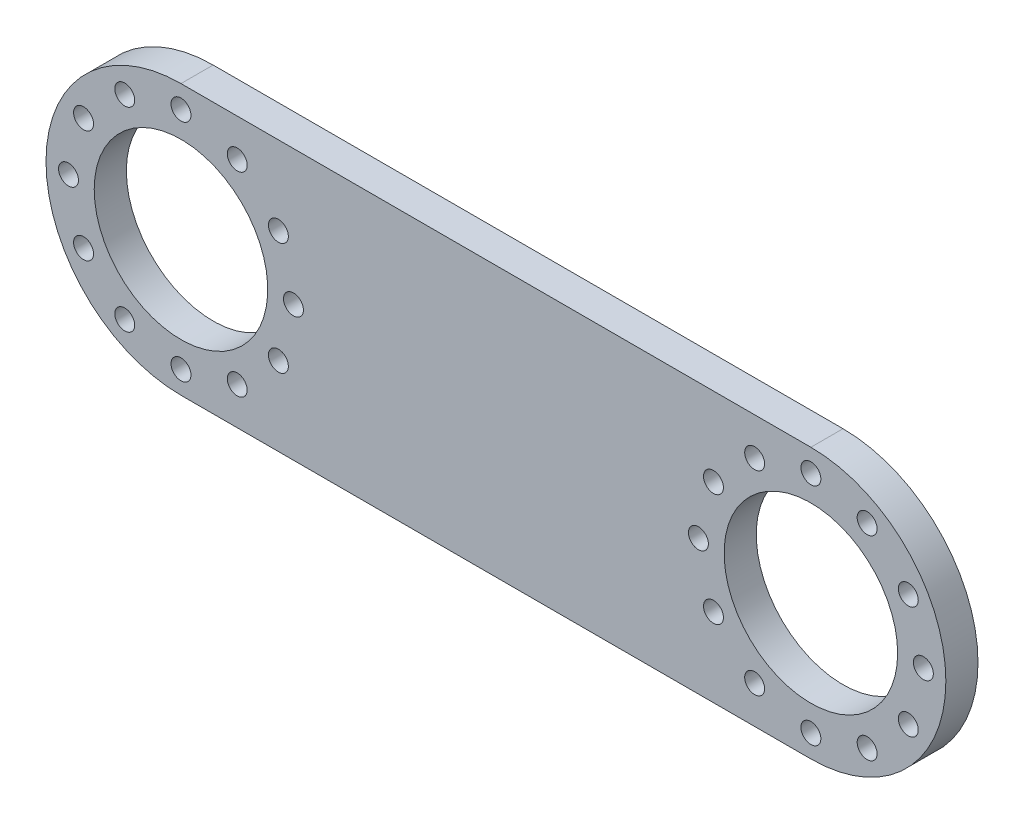
from build123d import *

# Parameters (mm, degrees)
EXTRUDE_1_DEPTH     = 5
SKETCH_2_R          = 13.5
SKETCH_2_R_2        = 1.55
CUT_EXTRUDE_1_DEPTH = 5


with BuildPart() as part:
    # 草图1 → 凸台-拉伸1 (new body)
    with BuildSketch(Plane.XY):
        with BuildLine():
            Line((-49, -21), (49, -21))
            ThreePointArc((49, -21), (70, 0), (49, 21))
            Line((49, 21), (-49, 21))
            ThreePointArc((-49, 21), (-70, 0), (-49, -21))
        make_face()
    extrude(amount=EXTRUDE_1_DEPTH)

    # 草图2 → 切除-拉伸1 (cut)
    with BuildSketch(Plane.XY.offset(5)):
        with Locations((49, 0)):
            Circle(SKETCH_2_R)
        with Locations((49, 17.5)):
            Circle(SKETCH_2_R_2)
        with Locations((57.75, 15.155444566)):
            Circle(SKETCH_2_R_2)
        with Locations((64.155444566, 8.75)):
            Circle(SKETCH_2_R_2)
        with Locations((66.5, 0)):
            Circle(SKETCH_2_R_2)
        with Locations((64.155444566, -8.75)):
            Circle(SKETCH_2_R_2)
        with Locations((57.75, -15.155444566)):
            Circle(SKETCH_2_R_2)
        with Locations((49, -17.5)):
            Circle(SKETCH_2_R_2)
        with Locations((40.25, -15.155444566)):
            Circle(SKETCH_2_R_2)
        with Locations((33.844555434, -8.75)):
            Circle(SKETCH_2_R_2)
        with Locations((31.5, 0)):
            Circle(SKETCH_2_R_2)
        with Locations((33.844555434, 8.75)):
            Circle(SKETCH_2_R_2)
        with Locations((40.25, 15.155444566)):
            Circle(SKETCH_2_R_2)
    cut_extrude_1 = extrude(amount=-CUT_EXTRUDE_1_DEPTH, mode=Mode.SUBTRACT)

    # 镜向1: 切除-拉伸1 across plane
    add(cut_extrude_1.mirror(Plane(origin=(0, 0, 0), x_dir=(0, 0, 1), z_dir=(1, 0, 0))), mode=Mode.SUBTRACT)


solid = part.part
